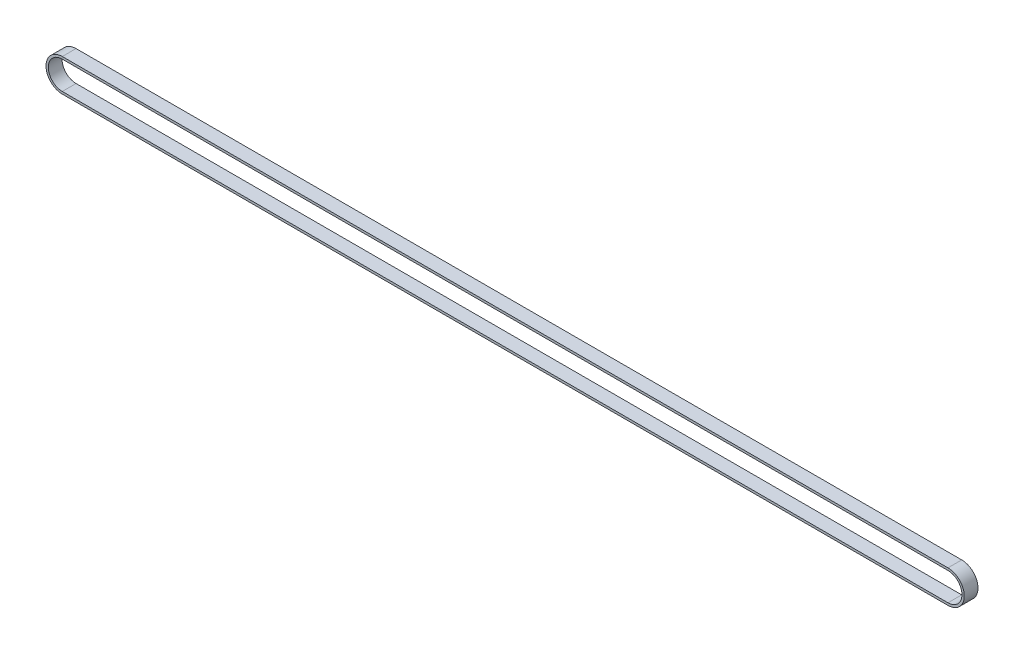
from build123d import *

# Parameters (mm, degrees)
EXTRUDE_THIN1_DEPTH = 6


with BuildPart() as part:
    # Sketch2 → Extrude-Thin1 (new body)
    with BuildSketch(Plane.XY):
        with BuildLine():
            Line((193.13, -6.1), (0, -6.1))
            ThreePointArc((0, -6.1), (-6.1, 0), (0, 6.1))
            Line((0, 6.1), (193.13, 6.1))
            Line((193.13, 6.1), (193.13, 7.1))
            Line((193.13, 7.1), (0, 7.1))
            ThreePointArc((0, 7.1), (-7.1, 0), (0, -7.1))
            Line((0, -7.1), (193.13, -7.1))
            Line((193.13, -7.1), (193.13, -6.1))
        make_face()
    extrude_thin1 = extrude(amount=EXTRUDE_THIN1_DEPTH)

    # Mirror1: Extrude-Thin1 across plane
    add(extrude_thin1.mirror(Plane(origin=(193.13, 7.1, 6), x_dir=(0, 0, 1), z_dir=(1, 0, 0))))


solid = part.part
